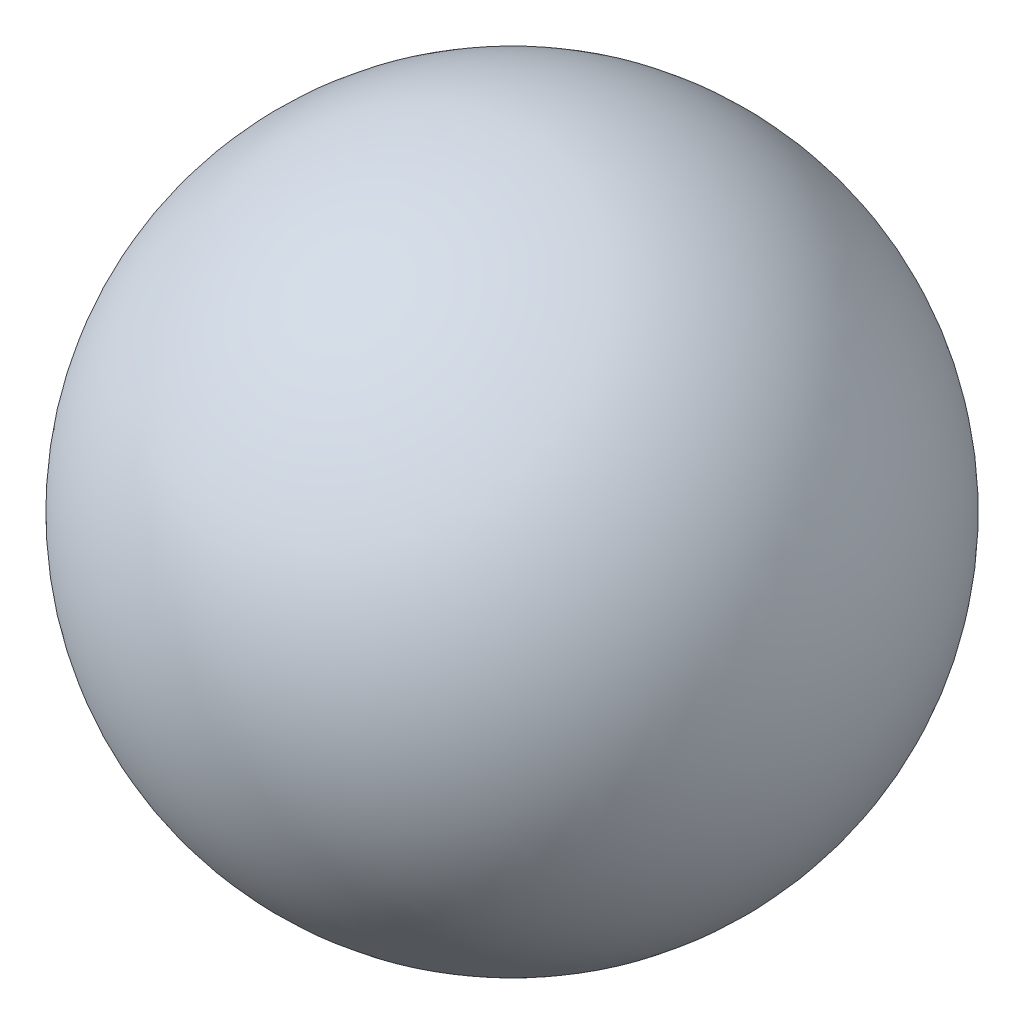
from build123d import *


with BuildPart() as part:
    # Sketch1 → Revolve1 (revolve)
    with BuildSketch(Plane.XY):
        with BuildLine():
            Line((0, -21.5), (0, 21.5))
            ThreePointArc((0, 21.5), (21.5, 0), (0, -21.5))
        make_face()
    revolve(axis=Axis((0, 25.3, 0), (0, -1, 0)))


solid = part.part
